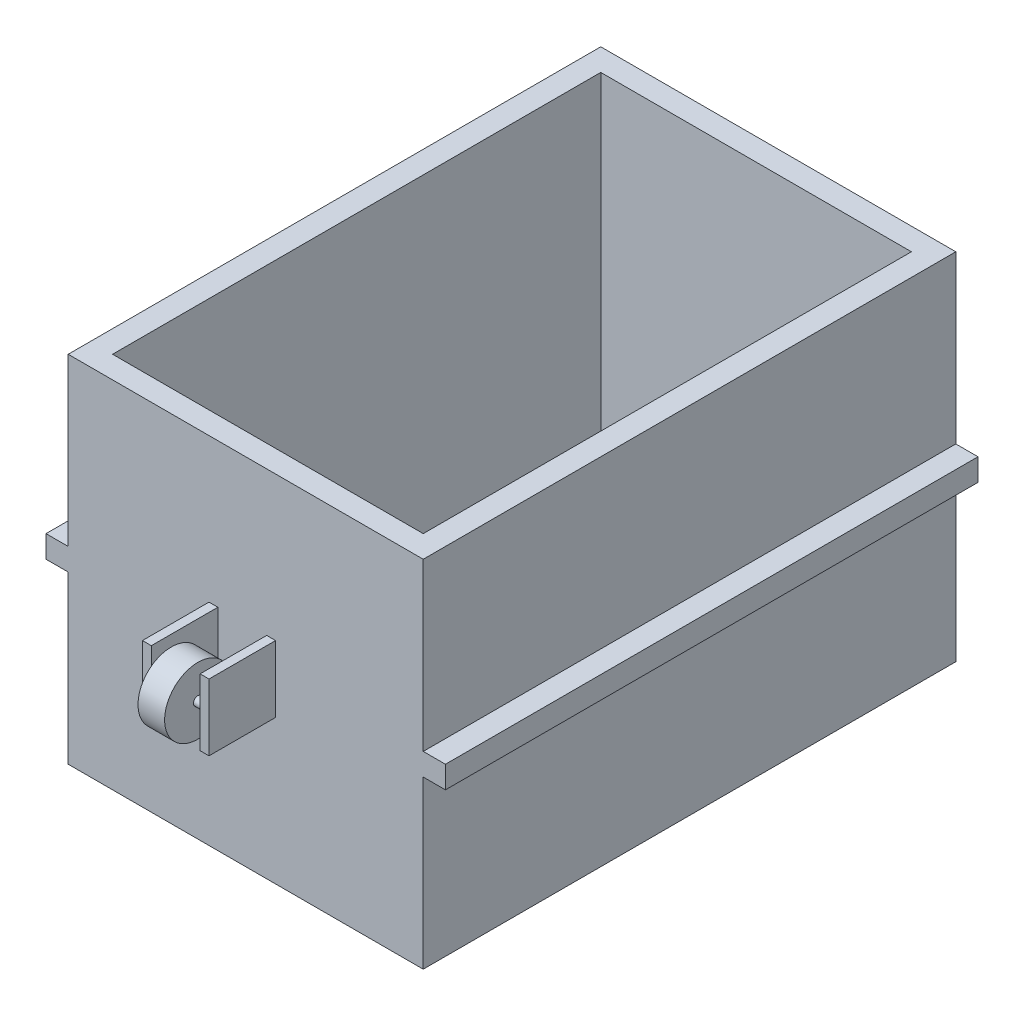
from build123d import *

# Parameters (mm, degrees)
SKETCH1_W                = 400
SKETCH1_H                = 400
BOSS_EXTRUDE1_DEPTH      = 600
SKETCH2_W                = 350
SKETCH2_H                = 550
CUT_EXTRUDE1_DEPTH       = 375
SKETCH3_W                = 25
SKETCH3_H                = 25
BOSS_EXTRUDE2_DEPTH      = 600
SKETCH4_W                = 75
SKETCH4_H                = 75
BOSS_EXTRUDE3_DEPTH      = 75
SKETCH5_W                = 55
SKETCH5_H                = 75
CUT_EXTRUDE2_DEPTH       = 75
BOSS_EXTRUDE4_START      = -22.5
SKETCH6_R                = 37.5
BOSS_EXTRUDE4_DEPTH      = 30
BOSS_EXTRUDE5_DEPTH      = 22
BOSS_EXTRUDE5_DEPTH_BACK = 44
SKETCH7_R                = 5


with BuildPart() as part:
    # Sketch1 → Boss-Extrude1 (new body)
    with BuildSketch(Plane.XY):
        with Locations((200, -200)):
            Rectangle(SKETCH1_W, SKETCH1_H)
    extrude(amount=BOSS_EXTRUDE1_DEPTH)

    # Sketch2 → Cut-Extrude1 (cut)
    with BuildSketch(Plane(origin=(0, 0, 0), x_dir=(1, 0, 0), z_dir=(0, 1, 0))):
        with Locations((200, -300)):
            Rectangle(SKETCH2_W, SKETCH2_H)
    extrude(amount=-CUT_EXTRUDE1_DEPTH, mode=Mode.SUBTRACT)

    # Sketch3 → Boss-Extrude2 (add)
    with BuildSketch(Plane.XY.offset(600)):
        with Locations((412.5, -200)):
            Rectangle(SKETCH3_W, SKETCH3_H)
        with Locations((-12.5, -200)):
            Rectangle(SKETCH3_W, SKETCH3_H)
    extrude(amount=-BOSS_EXTRUDE2_DEPTH)

    # Sketch4 → Boss-Extrude3 (add)
    with BuildSketch(Plane.XY.offset(600)):
        with Locations((196.145511261, -200)):
            Rectangle(SKETCH4_W, SKETCH4_H)
    extrude(amount=BOSS_EXTRUDE3_DEPTH)

    # Sketch5 → Cut-Extrude2 (cut)
    with BuildSketch(Plane(origin=(0, -162.5, 0), x_dir=(1, 0, 0), z_dir=(0, 1, 0))):
        with Locations((196.145511261, -637.5)):
            Rectangle(SKETCH5_W, SKETCH5_H)
    extrude(amount=-CUT_EXTRUDE2_DEPTH, mode=Mode.SUBTRACT)



with BuildPart() as body_2:
    # Sketch6 → Boss-Extrude4 (new body)
    with BuildSketch(Plane(origin=(233.645511261, 0, 0), x_dir=(0, 0, -1), z_dir=(1, 0, 0)).offset(BOSS_EXTRUDE4_START)):
        with Locations((-665, -200)):
            Circle(SKETCH6_R)
    extrude(amount=-BOSS_EXTRUDE4_DEPTH)


with BuildPart() as part_1:
    add(part.part)

    add(body_2.part)  # Boss-Extrude5 merges body 2
    # Sketch7 → Boss-Extrude5 (add, two sides: drawn at the far end of the back side and taken through both)
    with BuildSketch(Plane(origin=(211.145511261, 0, 0), x_dir=(0, 0, -1), z_dir=(1, 0, 0)).offset(-BOSS_EXTRUDE5_DEPTH_BACK)):
        with Locations((-665, -200)):
            Circle(SKETCH7_R)
    extrude(amount=BOSS_EXTRUDE5_DEPTH + BOSS_EXTRUDE5_DEPTH_BACK)


solid = part_1.part
